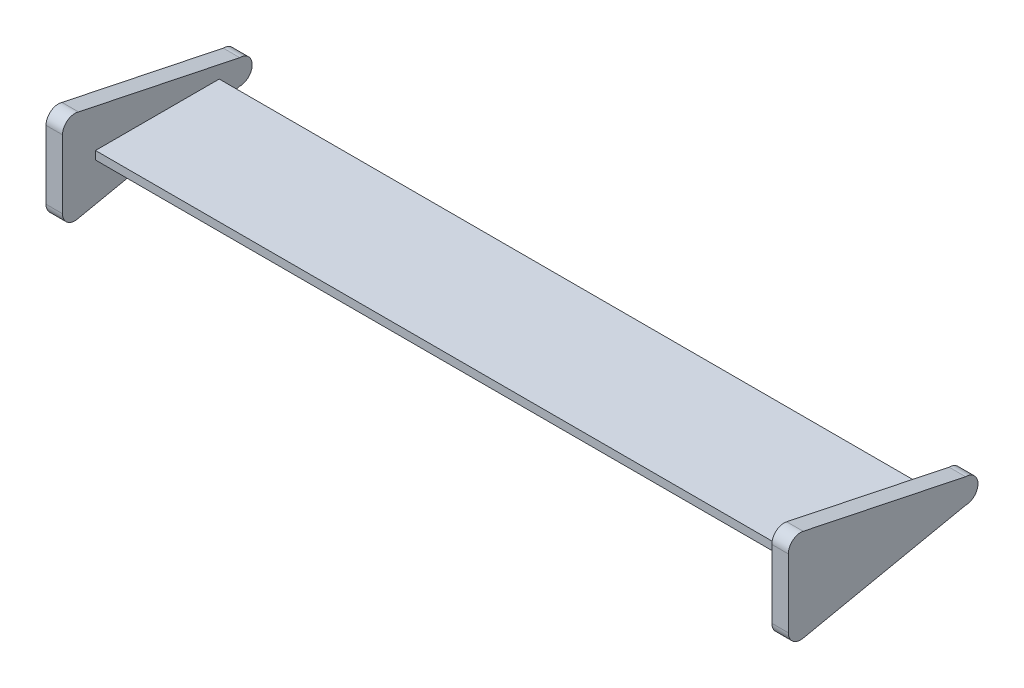
from build123d import *

# Parameters (mm, degrees)
SKETCH1_W           = 90
SKETCH1_H           = 15
BOSS_EXTRUDE1_DEPTH = 0.5
BOSS_EXTRUDE2_DEPTH = 2
BOSS_EXTRUDE3_START = -2
BOSS_EXTRUDE3_DEPTH = 2
SKETCH4_W           = 3
SKETCH4_H           = 3
CUT_EXTRUDE1_DEPTH  = 0.25


with BuildPart() as part:
    # Sketch1 → Boss-Extrude1 (new, symmetric)
    with BuildSketch(Plane(origin=(0, 0, 0), x_dir=(1, 0, 0), z_dir=(0, 1, 0))):
        Rectangle(SKETCH1_W, SKETCH1_H)
    extrude(amount=BOSS_EXTRUDE1_DEPTH, both=True)

    # Sketch2 → Boss-Extrude2 (add)
    with BuildSketch(Plane(origin=(45, 0, 0), x_dir=(0, 0, -1), z_dir=(1, 0, 0))):
        with BuildLine():
            Line((-11.5, 4.142135624), (-11.5, -4.142135624))
            ThreePointArc((-11.5, -4.142135624), (-10.946118457, -5.306120102), (-9.69352018, -5.610491888))
            Line((-9.69352018, -5.610491888), (10, -1.5))
            ThreePointArc((10, -1.5), (11.5, 0), (10, 1.5))
            Line((10, 1.5), (-9.69352018, 5.610491888))
            ThreePointArc((-9.69352018, 5.610491888), (-10.946118457, 5.306120102), (-11.5, 4.142135624))
        make_face()
    extrude(amount=-BOSS_EXTRUDE2_DEPTH)

    # Sketch3 → Boss-Extrude3 (add)
    with BuildSketch(Plane.ZY.offset(45).offset(BOSS_EXTRUDE3_START)):
        with BuildLine():
            Line((-10, 1.5), (9.553557208, 5.574158261))
            ThreePointArc((9.553557208, 5.574158261), (10.888913891, 5.350370739), (11.5, 4.142135624))
            Line((11.5, 4.142135624), (11.5, -4.142135624))
            ThreePointArc((11.5, -4.142135624), (10.888913891, -5.350370739), (9.553557208, -5.574158261))
            Line((9.553557208, -5.574158261), (-10, -1.5))
            ThreePointArc((-10, -1.5), (-11.5, 0), (-10, 1.5))
        make_face()
    extrude(amount=BOSS_EXTRUDE3_DEPTH)

    # Sketch4 → Cut-Extrude1 (cut, symmetric)
    with BuildSketch(Plane.XZ.offset(0.5)):
        with Locations((13.5, 0)):
            Rectangle(SKETCH4_W, SKETCH4_H)
        with Locations((-13.5, 0)):
            Rectangle(SKETCH4_W, SKETCH4_H)
    extrude(amount=CUT_EXTRUDE1_DEPTH, both=True, mode=Mode.SUBTRACT)


solid = part.part
